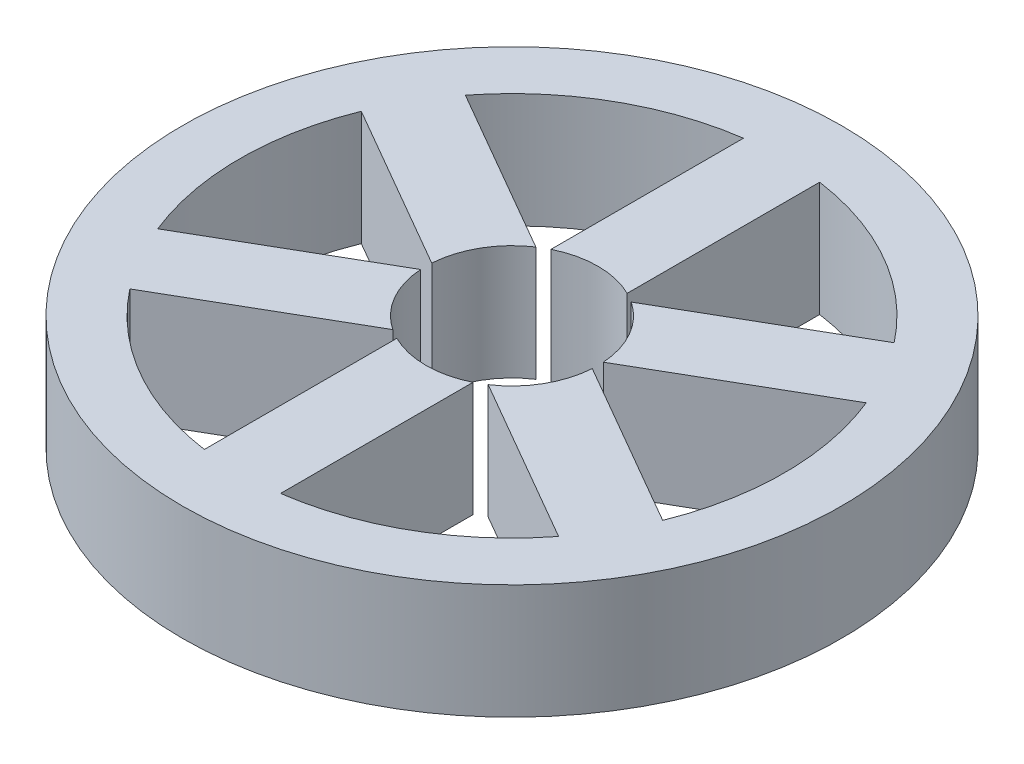
from build123d import *

# Parameters (mm, degrees)
SKETCH1_R           = 5.75
BOSS_EXTRUDE1_DEPTH = 2


with BuildPart() as part:
    # Sketch1 → Boss-Extrude1 (new body)
    with BuildSketch(Plane(origin=(0, 0, 0), x_dir=(1, 0, 0), z_dir=(0, 1, 0))):
        with Locations(Location((0, 0, 0), (0, 0, 270))):
            Circle(SKETCH1_R)
        with BuildLine():
            ThreePointArc((1.496877193, -0.096740213), (1.299038106, -0.75), (0.832218079, -1.247963569))
            Line((0.832218079, -1.247963569), (3.740819863, -2.927245592))
            ThreePointArc((3.740819863, -2.927245592), (2.375, -4.113620668), (0.664659115, -4.703267828))
            Line((0.664659115, -4.703267828), (0.664659115, -1.344703782))
            ThreePointArc((0.664659115, -1.344703782), (0, -1.5), (-0.664659115, -1.344703782))
            Line((-0.664659115, -1.344703782), (-0.664659115, -4.703267828))
            ThreePointArc((-0.664659115, -4.703267828), (-2.375, -4.113620668), (-3.740819863, -2.927245592))
            Line((-3.740819863, -2.927245592), (-0.832218079, -1.247963569))
            ThreePointArc((-0.832218079, -1.247963569), (-1.299038106, -0.75), (-1.496877193, -0.096740213))
            Line((-1.496877193, -0.096740213), (-4.405478977, -1.776022236))
            ThreePointArc((-4.405478977, -1.776022236), (-4.75, 0), (-4.405478977, 1.776022236))
            Line((-4.405478977, 1.776022236), (-1.496877193, 0.096740213))
            ThreePointArc((-1.496877193, 0.096740213), (-1.299038106, 0.75), (-0.832218079, 1.247963569))
            Line((-0.832218079, 1.247963569), (-3.740819863, 2.927245592))
            ThreePointArc((-3.740819863, 2.927245592), (-2.375, 4.113620668), (-0.664659115, 4.703267828))
            Line((-0.664659115, 4.703267828), (-0.664659115, 1.344703782))
            ThreePointArc((-0.664659115, 1.344703782), (0, 1.5), (0.664659115, 1.344703782))
            Line((0.664659115, 1.344703782), (0.664659115, 4.703267828))
            ThreePointArc((0.664659115, 4.703267828), (2.375, 4.113620668), (3.740819863, 2.927245592))
            Line((3.740819863, 2.927245592), (0.832218079, 1.247963569))
            ThreePointArc((0.832218079, 1.247963569), (1.299038106, 0.75), (1.496877193, 0.096740213))
            Line((1.496877193, 0.096740213), (4.405478977, 1.776022236))
            ThreePointArc((4.405478977, 1.776022236), (4.75, 0), (4.405478977, -1.776022236))
            Line((4.405478977, -1.776022236), (1.496877193, -0.096740213))
        make_face(mode=Mode.SUBTRACT)
    extrude(amount=BOSS_EXTRUDE1_DEPTH)


solid = part.part
